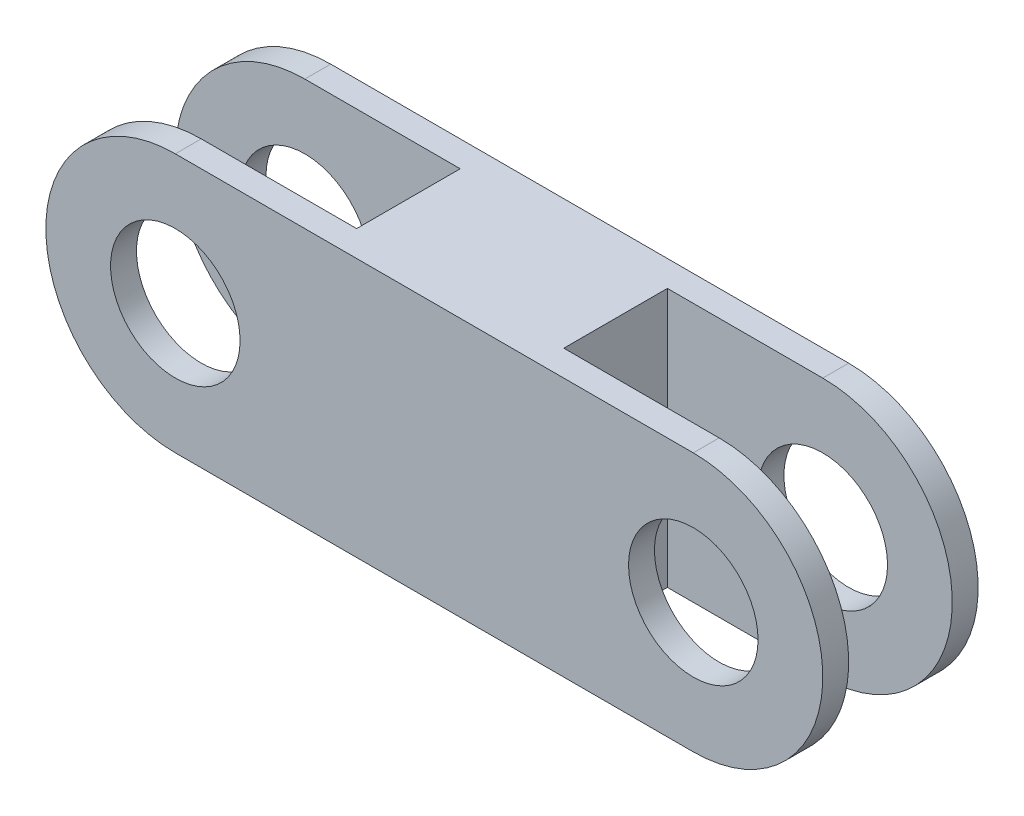
from build123d import *

# Parameters (mm, degrees)
SKETCH1_R           = 2.5
BOSS_EXTRUDE1_DEPTH = 3
SKETCH2_W           = 20
SKETCH2_H           = 4
CUT_EXTRUDE1_DEPTH  = 28.092434368


with BuildPart() as part:
    # Sketch1 → Boss-Extrude1 (new, symmetric)
    with BuildSketch(Plane.XY):
        with BuildLine():
            Line((0, 5), (20, 5))
            ThreePointArc((20, 5), (25, 0), (20, -5))
            Line((20, -5), (0, -5))
            ThreePointArc((0, -5), (-5, 0), (0, 5))
        make_face()
        Circle(SKETCH1_R, mode=Mode.SUBTRACT)
        with Locations((20, 0)):
            Circle(SKETCH1_R, mode=Mode.SUBTRACT)
    extrude(amount=BOSS_EXTRUDE1_DEPTH, both=True)

    # Sketch2 → Cut-Extrude1 (cut, through all)
    with BuildSketch(Plane(origin=(0, 5, 0), x_dir=(1, 0, 0), z_dir=(0, 1, 0))):
        with Locations((-4, 0)):
            Rectangle(SKETCH2_W, SKETCH2_H)
    cut_extrude1 = extrude(amount=-CUT_EXTRUDE1_DEPTH, mode=Mode.SUBTRACT)

    # Mirror1: Cut-Extrude1 across plane
    add(cut_extrude1.mirror(Plane(origin=(10, 0, 0), x_dir=(0, 0, 1), z_dir=(1, 0, 0))), mode=Mode.SUBTRACT)


solid = part.part
